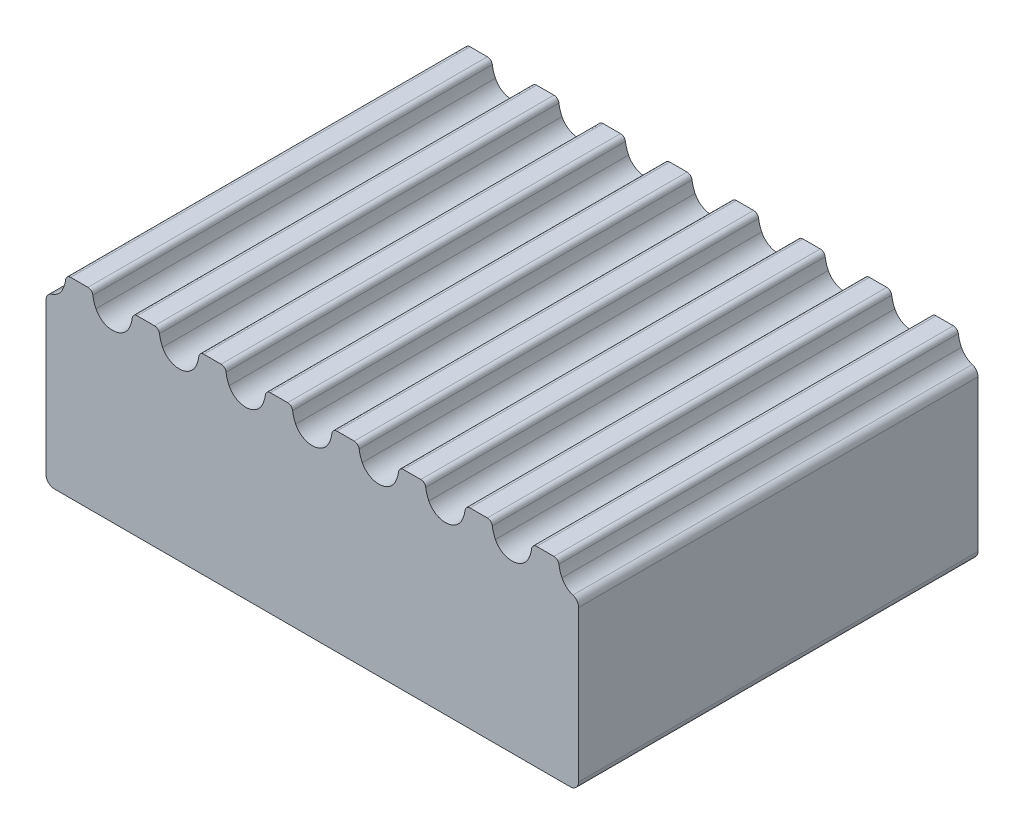
from build123d import *

# Parameters (mm, degrees)
BOSS_EXTRUDE1_DEPTH = 6
LPATTERN1_COUNT     = 8
LPATTERN1_PITCH     = 2
SKETCH4_W           = 16
SKETCH4_H           = 6.004
BOSS_EXTRUDE3_DEPTH = 6
FILLET1_R           = 0.25


with BuildPart() as part:
    # Sketch1 → Boss-Extrude1 (new, symmetric)
    with BuildSketch(Plane.XY):
        with BuildLine():
            Line((0, 0), (1, 0))
            Line((1, 0), (1, -1.004))
            ThreePointArc((1, -1.004), (0.705850588, -0.919639059), (0.501123596, -0.692202247))
            ThreePointArc((0.501123596, -0.692202247), (0.442388286, -0.542062154), (0.408543109, -0.384434783))
            ThreePointArc((0.408543109, -0.384434783), (0.358731646, -0.291228588), (0.259824575, -0.254))
            Line((0.259824575, -0.254), (0, -0.254))
            Line((0, -0.254), (0, 0))
        make_face()
    extrude(amount=BOSS_EXTRUDE1_DEPTH, both=True)

    # Mirror1: part across plane


with BuildPart() as part_1:
    add(part.part)
    add(part.part.mirror(Plane(origin=(0, 0, 6), x_dir=(0, 0, 1), z_dir=(1, 0, 0))))


with BuildPart() as lpattern1_1:
    # LPattern1: pattern copy
    add(part_1.part.moved(Location(Vector(-1, 0, 0) * (1 * LPATTERN1_PITCH))))


with BuildPart() as lpattern1_2:
    # LPattern1: pattern copy
    add(part_1.part.moved(Location(Vector(-1, 0, 0) * (2 * LPATTERN1_PITCH))))


with BuildPart() as lpattern1_3:
    # LPattern1: pattern copy
    add(part_1.part.moved(Location(Vector(-1, 0, 0) * (3 * LPATTERN1_PITCH))))


with BuildPart() as lpattern1_4:
    # LPattern1: pattern copy
    add(part_1.part.moved(Location(Vector(-1, 0, 0) * (4 * LPATTERN1_PITCH))))


with BuildPart() as lpattern1_5:
    # LPattern1: pattern copy
    add(part_1.part.moved(Location(Vector(-1, 0, 0) * (5 * LPATTERN1_PITCH))))


with BuildPart() as lpattern1_6:
    # LPattern1: pattern copy
    add(part_1.part.moved(Location(Vector(-1, 0, 0) * (6 * LPATTERN1_PITCH))))


with BuildPart() as lpattern1_7:
    # LPattern1: pattern copy
    add(part_1.part.moved(Location(Vector(-1, 0, 0) * (7 * LPATTERN1_PITCH))))


with BuildPart() as lpattern1_1_1:
    add(lpattern1_1.part)

    # Combine1: union LPattern1_4, part, LPattern1_3, LPattern1_2, LPattern1_5, LPattern1_6, LPattern1_7
    add(lpattern1_4.part)
    add(part_1.part)
    add(lpattern1_3.part)
    add(lpattern1_2.part)
    add(lpattern1_5.part)
    add(lpattern1_6.part)
    add(lpattern1_7.part)


with BuildPart() as body_2:
    # Sketch4 → Boss-Extrude3 (new, symmetric)
    with BuildSketch(Plane.XY):
        with Locations((-7, -3.002)):
            Rectangle(SKETCH4_W, SKETCH4_H)
    extrude(amount=BOSS_EXTRUDE3_DEPTH, both=True)

    # Combine2: cut LPattern1_1
    add(lpattern1_1_1.part, mode=Mode.SUBTRACT)

    # Fillet1
    fillet1_edges = [body_2.edges().sort_by_distance(p)[0] for p in [
        (-15, -1.004, 0),
        (1, -1.004, 0),
        (1, -6.004, 0),
        (-15, -6.004, 0),
    ]]
    fillet(fillet1_edges, radius=FILLET1_R)


solid = body_2.part
